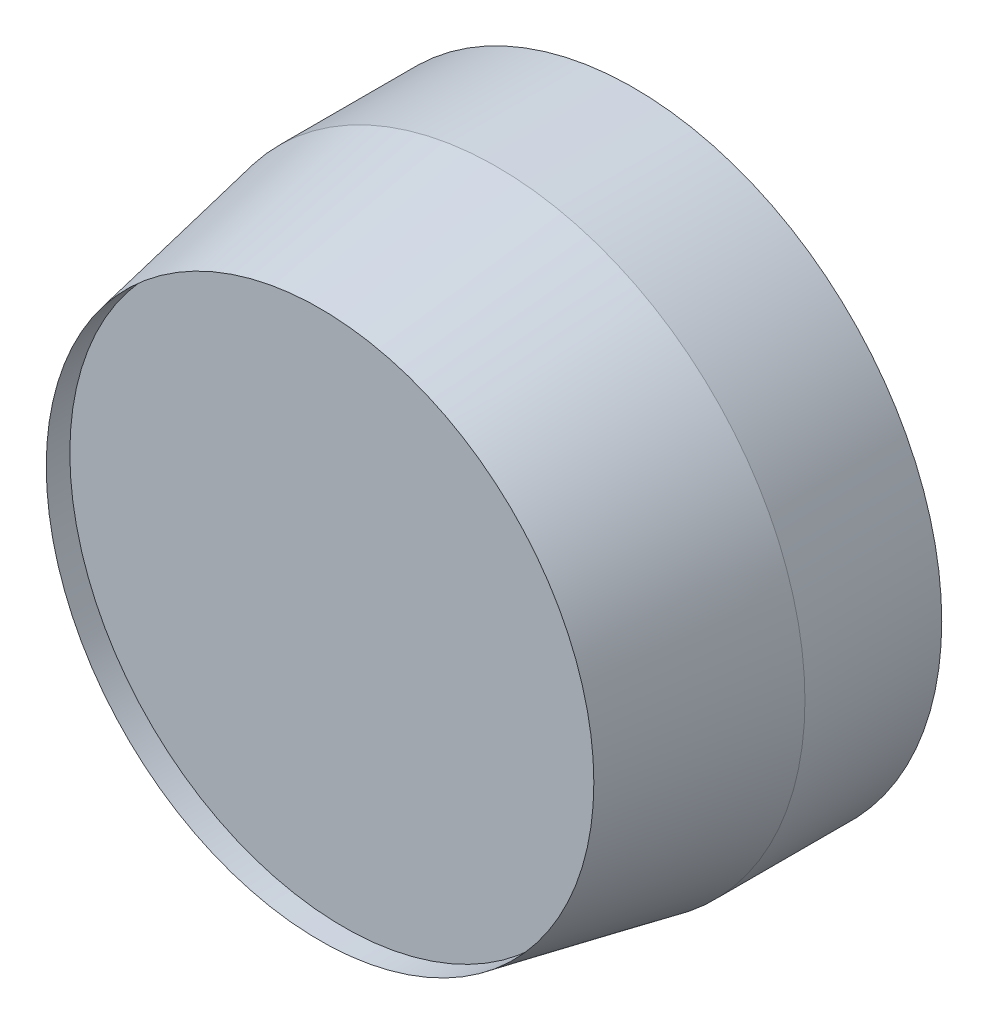
from build123d import *

# Parameters (mm, degrees)
SKETCH1_R           = 33.167751503
SKETCH1_R_2         = 31.877533848
BOSS_EXTRUDE1_DEPTH = 14.732
SKETCH4_R           = 29.484523805
SKETCH1_3_R         = 33.167751503
SKETCH5_R           = 29.484523805
CUT_EXTRUDE1_DEPTH  = 2.54
SCALE1_SCALE        = 13


with BuildPart() as part:
    # Sketch1 → Boss-Extrude1 (new body)
    with BuildSketch(Plane.XY):
        with Locations((-9.170341316, 25.326095841)):
            Circle(SKETCH1_R)
        with Locations((-9.170341316, 25.326095841)):
            Circle(SKETCH1_R_2, mode=Mode.SUBTRACT)
    extrude(amount=-BOSS_EXTRUDE1_DEPTH)

    # Sketch4 → Loft1 section 0
    with BuildSketch(Plane.XY.offset(19.05)):
        with Locations((-9.170341316, 25.326095841)):
            Circle(SKETCH4_R)
    # Sketch1<3> → Loft1 section 1
    with BuildSketch(Plane.XY):
        with Locations((-9.170341316, 25.326095841)):
            Circle(SKETCH1_3_R)
    loft()

    # Sketch5 → Cut-Extrude1 (cut)
    with BuildSketch(Plane.XY.offset(19.05)):
        with Locations((-9.170341316, 25.326095841)):
            Circle(SKETCH5_R)
    extrude(amount=-CUT_EXTRUDE1_DEPTH, mode=Mode.SUBTRACT)


with BuildPart() as part_1:
    # Scale1: scaled about (-9.170341316, 25.326095841, 6.927517959)
    add(part.part.scale(SCALE1_SCALE).moved(Location((110.044095792, -303.913150092, -83.130215508))))


solid = part_1.part
